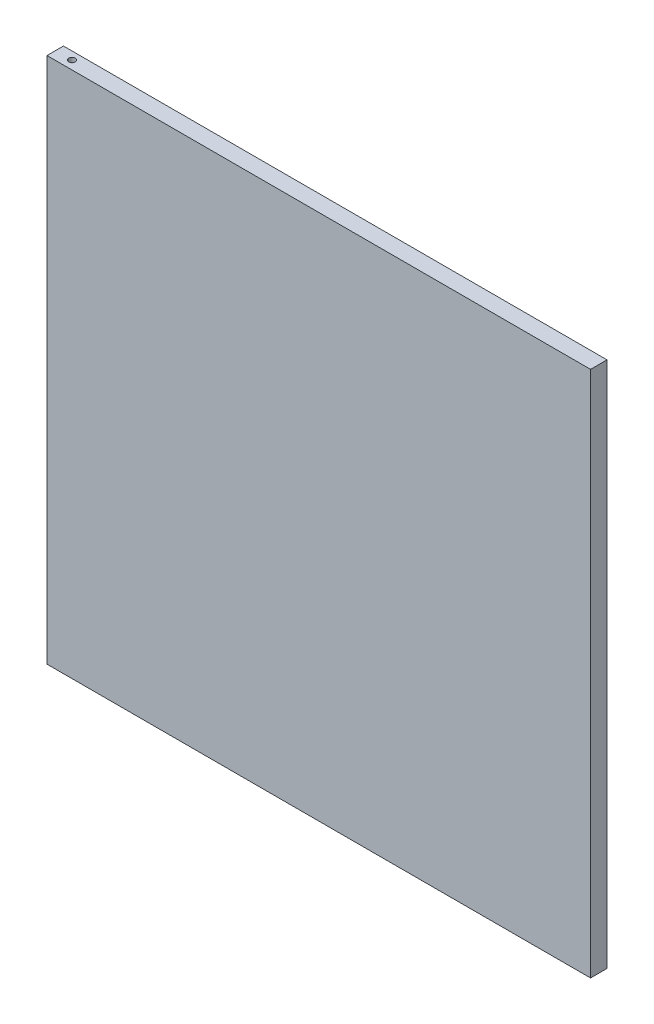
from build123d import *

# Parameters (mm, degrees)
SZKIC1_W                    = 825
SZKIC1_H                    = 800
DODANIE_WYCI_GNI_CIE1_DEPTH = 25
SZKIC3_R                    = 5
WYTNIJ_WYCI_GNI_CIE1_DEPTH  = 40


with BuildPart() as part:
    # Szkic1 → Dodanie-wyciągnięcie1 (new body)
    with BuildSketch(Plane.XY):
        with Locations((412.5, 400)):
            Rectangle(SZKIC1_W, SZKIC1_H)
    extrude(amount=DODANIE_WYCI_GNI_CIE1_DEPTH)

    # Szkic3 → Wytnij-wyciągnięcie1 (cut)
    with BuildSketch(Plane(origin=(0, 0, 0), x_dir=(1, 0, 0), z_dir=(0, 1, 0))):
        with Locations(Location((25, -12, 0), (0, 0, 270))):
            Circle(SZKIC3_R)
    wytnij_wyci_gni_cie1 = extrude(amount=WYTNIJ_WYCI_GNI_CIE1_DEPTH, mode=Mode.SUBTRACT)

    # Lustro1: Wytnij-wyciągnięcie1 across plane
    add(wytnij_wyci_gni_cie1.mirror(Plane.ZX.offset(400)), mode=Mode.SUBTRACT)


solid = part.part
